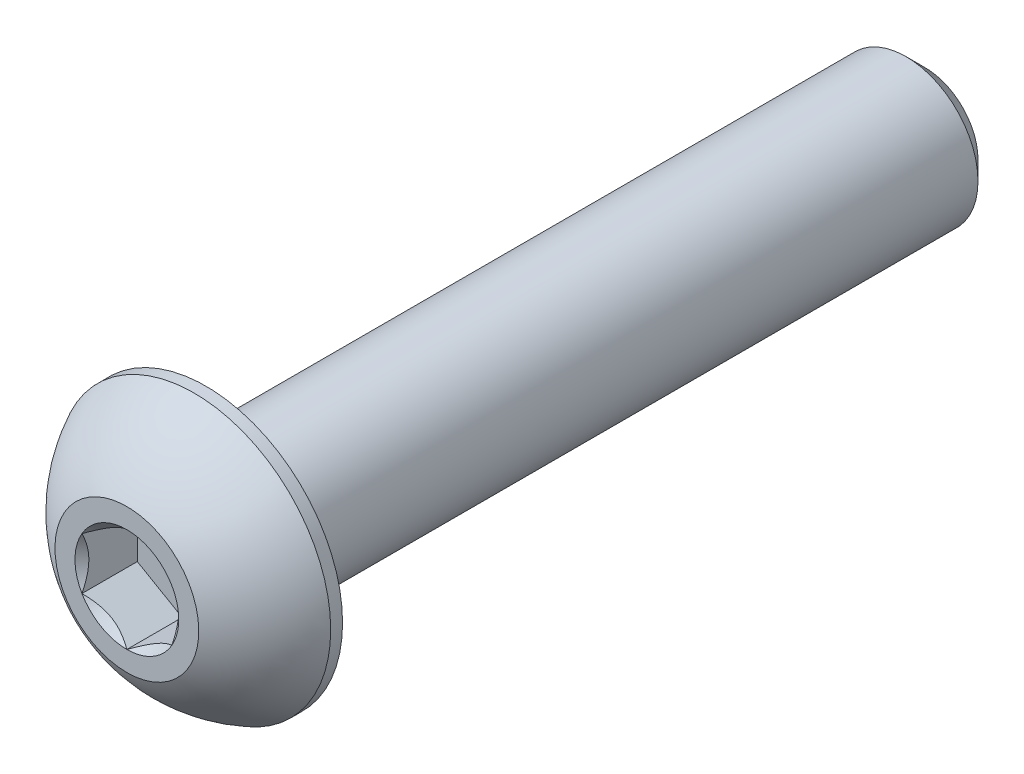
from build123d import *

# Parameters (mm, degrees)
CUT_EXTRUDE2_DEPTH = 1.54


with BuildPart() as part:
    # Sketch10 → Revolve3 (revolve)
    with BuildSketch(Plane(origin=(0, 0, 0), x_dir=(0, 0, -1), z_dir=(1, 0, 0))):
        Polygon((21.675, 2), (22.2, 1.475), (22.2, 0), (2.2, 0), (2.2, 2), align=None)
    revolve(axis=Axis((0, 0, 0), (0, 0, -1)))

    # Sketch7 → Revolve2 (revolve)
    with BuildSketch(Plane(origin=(0, 0, 0), x_dir=(0, 0, -1), z_dir=(1, 0, 0))):
        with BuildLine():
            Line((1.87, 3.8), (2.2, 3.8))
            Line((2.2, 3.8), (2.2, 0))
            Line((2.2, 0), (0, 0))
            Line((0, 0), (0, 2))
            ThreePointArc((0, 2), (0.793500147, 3.047002626), (1.87, 3.8))
        make_face()
    revolve(axis=Axis((0, 0, 0), (0, 0, -1)))

    # Sketch5 → Cut-Extrude2 (cut)
    with BuildSketch(Plane.XY):
        Polygon((1.25, -0.721687836), (1.25, 0.721687836), (0, 1.443375673), (-1.25, 0.721687836), (-1.25, -0.721687836), (0, -1.443375673), align=None)
    extrude(amount=-CUT_EXTRUDE2_DEPTH, mode=Mode.SUBTRACT)

    # Cut-Extrude3 cone 1 section (through the dimple's axis) → Cut-Extrude3 (revolve, cut)
    with BuildSketch(Plane(origin=(0, 0, 0), x_dir=(0, -1, 0), z_dir=(1, 0, 0))):
        Polygon((0, 0), (1.443375673, 0), (0, 1.443375673), align=None)
    revolve(axis=Axis((0, 0, 0), (0, 0, -1)), mode=Mode.SUBTRACT)


solid = part.part
